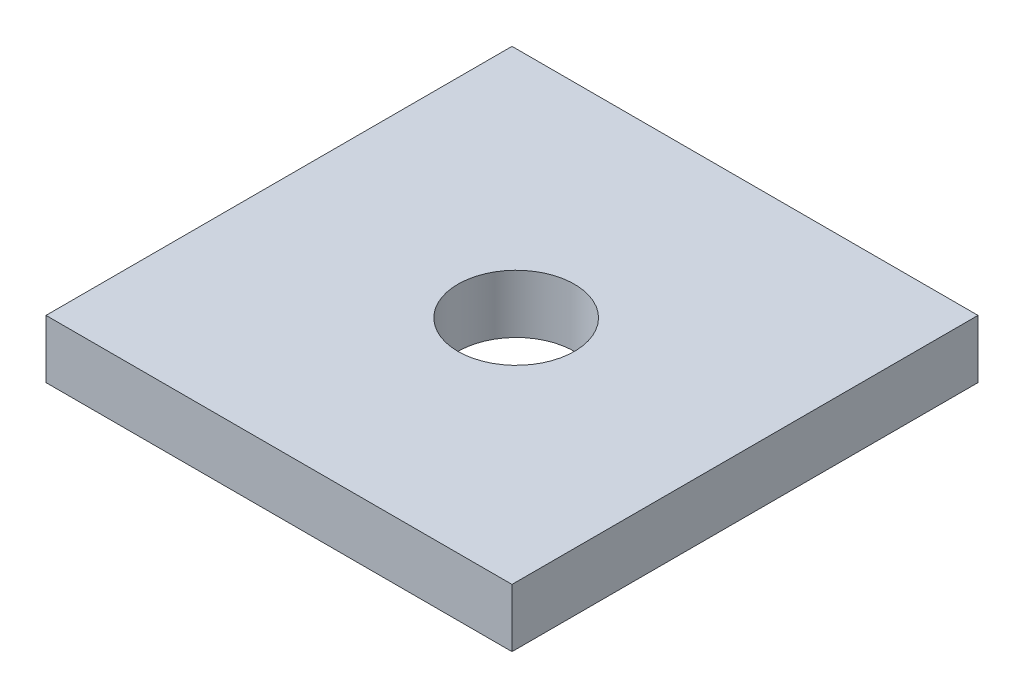
from build123d import *

# Parameters (mm, degrees)
SKETCH1_W           = 25.4
SKETCH1_H           = 25.4
BOSS_EXTRUDE1_DEPTH = 3.175
SKETCH2_R           = 3.175
CUT_EXTRUDE1_DEPTH  = 37.061067996


with BuildPart() as part:
    # Sketch1 → Boss-Extrude1 (new body)
    with BuildSketch(Plane(origin=(0, 0, 0), x_dir=(1, 0, 0), z_dir=(0, 1, 0))):
        with Locations((12.7, 12.7)):
            Rectangle(SKETCH1_W, SKETCH1_H)
    extrude(amount=BOSS_EXTRUDE1_DEPTH)

    # Sketch2 → Cut-Extrude1 (cut, through all)
    with BuildSketch(Plane(origin=(0, 3.175, 0), x_dir=(1, 0, 0), z_dir=(0, 1, 0))):
        with Locations(Location((12.927583797, 12.7, 0), (0, 0, 270))):
            Circle(SKETCH2_R)
    extrude(amount=-CUT_EXTRUDE1_DEPTH, mode=Mode.SUBTRACT)


solid = part.part
